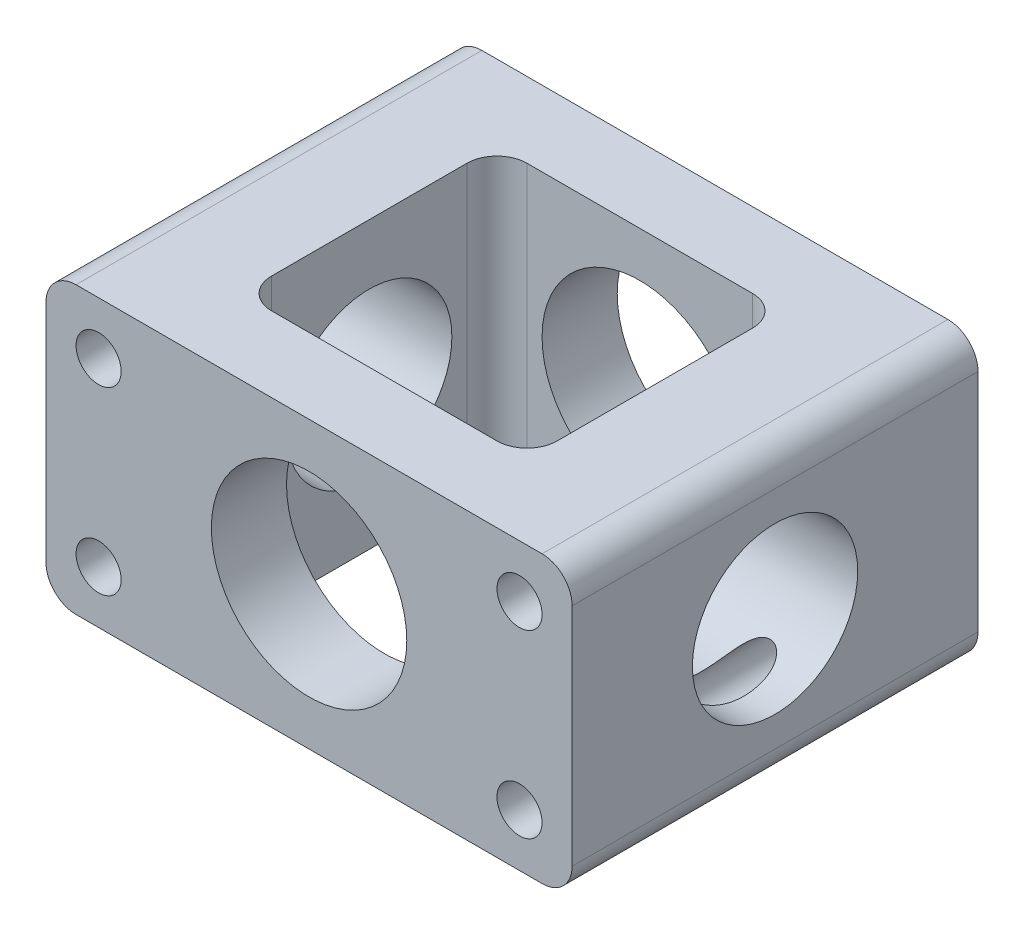
from build123d import *

# Parameters (mm, degrees)
SKETCH_1_W          = 35
SKETCH_1_H          = 19
SKETCH_1_R          = 1.5
EXTRUDE_1_DEPTH     = 27
SKETCH_2_W          = 19
SKETCH_2_H          = 17
CUT_EXTRUDE_1_DEPTH = 38.366428783
SKETCH_3_R          = 5.5
CUT_EXTRUDE_2_DEPTH = 46.213382975
SKETCH_4_R          = 6.5
CUT_EXTRUDE_3_DEPTH = 34.548472527
FILLET_1_R          = 2
FILLET_2_R          = 2


with BuildPart() as part:
    # 草图1 → 凸台-拉伸1 (new body)
    with BuildSketch(Plane.XY):
        Rectangle(SKETCH_1_W, SKETCH_1_H)
        with Locations((-14, 6)):
            Circle(SKETCH_1_R, mode=Mode.SUBTRACT)
        with Locations((14, 6)):
            Circle(SKETCH_1_R, mode=Mode.SUBTRACT)
        with Locations((14, -6)):
            Circle(SKETCH_1_R, mode=Mode.SUBTRACT)
        with Locations((-14, -6)):
            Circle(SKETCH_1_R, mode=Mode.SUBTRACT)
    extrude(amount=EXTRUDE_1_DEPTH)

    # 草图2 → 切除-拉伸1 (cut, through all)
    with BuildSketch(Plane.XZ.offset(9.5)):
        with Locations((0, 13.5)):
            Rectangle(SKETCH_2_W, SKETCH_2_H)
    extrude(amount=-CUT_EXTRUDE_1_DEPTH, mode=Mode.SUBTRACT)

    # 草图3 → 切除-拉伸2 (cut, through all)
    with BuildSketch(Plane.ZY.offset(17.5)):
        with Locations((13.5, 0)):
            Circle(SKETCH_3_R)
    extrude(amount=-CUT_EXTRUDE_2_DEPTH, mode=Mode.SUBTRACT)

    # 草图4 → 切除-拉伸3 (cut, through all)
    with BuildSketch(Plane.XY.offset(27)):
        Circle(SKETCH_4_R)
    extrude(amount=-CUT_EXTRUDE_3_DEPTH, mode=Mode.SUBTRACT)

    # 圆角1
    fillet_1_edges = [part.edges().sort_by_distance(p)[0] for p in [
        (9.5, 0, 22),
        (9.5, 0, 5),
        (-9.5, 0, 5),
        (-9.5, 0, 22),
    ]]
    fillet(fillet_1_edges, radius=FILLET_1_R)

    # 圆角2
    fillet_2_edges = [part.edges().sort_by_distance(p)[0] for p in [
        (17.5, -9.5, 13.5),
        (-17.5, -9.5, 13.5),
        (-17.5, 9.5, 13.5),
        (17.5, 9.5, 13.5),
    ]]
    fillet(fillet_2_edges, radius=FILLET_2_R)


solid = part.part
